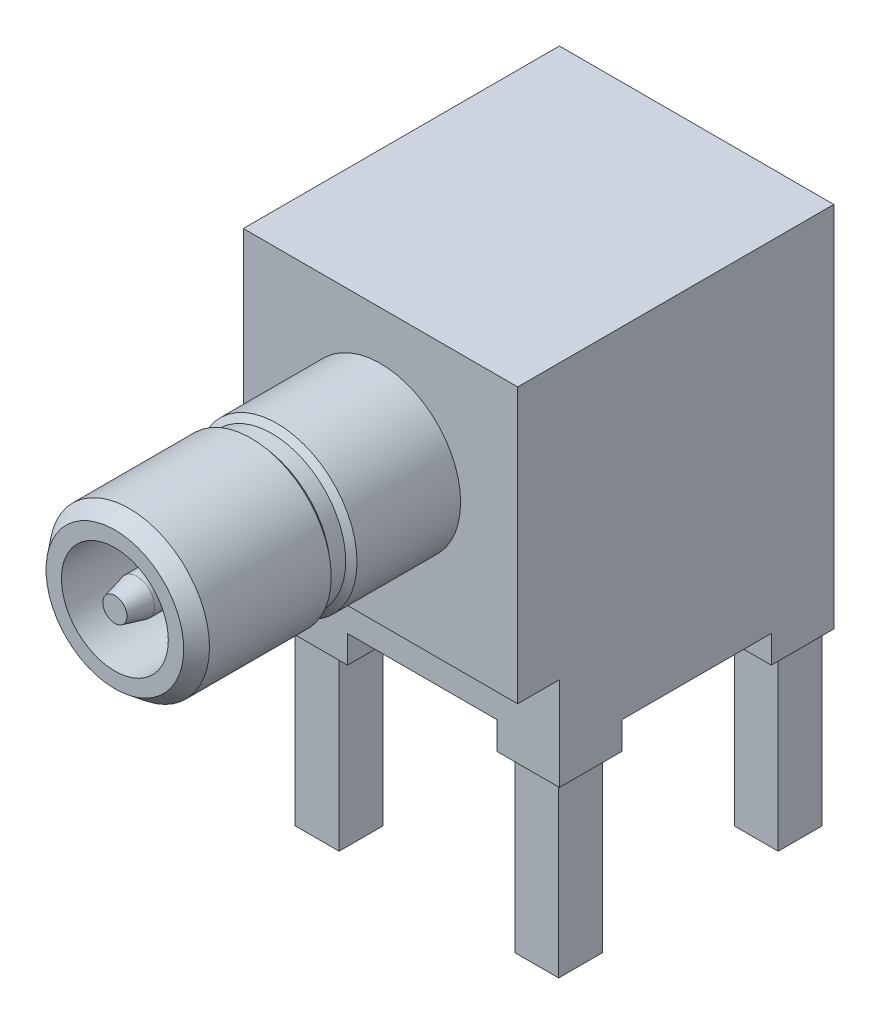
from build123d import *

# Parameters (mm, degrees)
SKETCH1_W          = 6.35
SKETCH1_H          = 6.35
EXTRUDE1_DEPTH     = 7.874
SKETCH2_W          = 1.4478
SKETCH2_H          = 1.4478
EXTRUDE2_DEPTH     = 0.635
SKETCH3_W          = 1.016
SKETCH3_H          = 1.016
EXTRUDE3_DEPTH     = 3.937
SKETCH4_R          = 1.693605641
CUT_EXTRUDE1_DEPTH = 0.254
SKETCH5_R          = 0.4826
EXTRUDE4_DEPTH     = 4.826
SKETCH6_W          = 6.35
SKETCH6_H          = 6.35
EXTRUDE5_DEPTH     = 0.9652
SKETCH7_R          = 1.8542
EXTRUDE6_DEPTH     = 6.1468
SKETCH9_R          = 1.236423773
CUT_EXTRUDE2_DEPTH = 5.658092827
SKETCH10_R         = 0.406972167
EXTRUDE7_DEPTH     = 5.658092827
CHAMFER1_SIZE      = 0.508
CHAMFER1_SIZE2     = 0.126658625


with BuildPart() as part:
    # Sketch1 → Extrude1 (new body)
    with BuildSketch(Plane(origin=(0, 0, 0), x_dir=(1, 0, 0), z_dir=(0, 1, 0))):
        with Locations((3.175, 3.175)):
            Rectangle(SKETCH1_W, SKETCH1_H)
    extrude(amount=EXTRUDE1_DEPTH)

    # Sketch2 → Extrude2 (add)
    with BuildSketch(Plane.XZ):
        with Locations((5.6261, -0.7239)):
            Rectangle(SKETCH2_W, SKETCH2_H)
        with Locations((5.6261, -5.6261)):
            Rectangle(SKETCH2_W, SKETCH2_H)
        with Locations((0.7239, -5.6261)):
            Rectangle(SKETCH2_W, SKETCH2_H)
        with Locations((0.7239, -0.7239)):
            Rectangle(SKETCH2_W, SKETCH2_H)
    extrude(amount=EXTRUDE2_DEPTH)

    # Sketch3 → Extrude3 (add)
    with BuildSketch(Plane.XZ.offset(0.635)):
        with Locations((5.715, -0.617649022)):
            Rectangle(SKETCH3_W, SKETCH3_H)
        with Locations((5.715, -5.697649022)):
            Rectangle(SKETCH3_W, SKETCH3_H)
        with Locations((0.635, -5.697649022)):
            Rectangle(SKETCH3_W, SKETCH3_H)
        with Locations((0.635, -0.617649022)):
            Rectangle(SKETCH3_W, SKETCH3_H)
    extrude(amount=EXTRUDE3_DEPTH)

    # Sketch4 → Cut-Extrude1 (cut)
    with BuildSketch(Plane.XZ):
        with Locations(Location((3.175, -3.175, 0), (0, 0, 270))):
            Circle(SKETCH4_R)
    extrude(amount=-CUT_EXTRUDE1_DEPTH, mode=Mode.SUBTRACT)

    # Sketch5 → Extrude4 (add)
    with BuildSketch(Plane.XZ.offset(-0.254)):
        with Locations(Location((3.175, -3.175, 0), (0, 0, 90))):
            Circle(SKETCH5_R)
    extrude(amount=EXTRUDE4_DEPTH)

    # Sketch6 → Extrude5 (add)
    with BuildSketch(Plane.XY):
        with Locations((3.175, 4.699)):
            Rectangle(SKETCH6_W, SKETCH6_H)
    extrude(amount=EXTRUDE5_DEPTH)

    # Sketch7 → Extrude6 (add)
    with BuildSketch(Plane.XY.offset(0.9652)):
        with Locations((3.175, 4.9022)):
            Circle(SKETCH7_R)
    extrude(amount=EXTRUDE6_DEPTH)

    # Sketch8 → Cut-Revolve1 (revolve, cut)
    with BuildSketch(Plane(origin=(0, 4.9022, 0), x_dir=(-1, 0, 0), z_dir=(0, 1, 0))):
        Polygon((-4.767796954, 7.112), (-5.0292, 6.777141647), (-5.0292, 3.959542683), (-4.884349235, 3.83568961), (-4.884349235, 3.47951039), (-5.0292, 3.363076056), (-5.0292, 0.9652), (-5.650551893, 0.9652), (-5.650551893, 7.801111761), align=None)
    revolve(axis=Axis((3.175, 4.9022, 7.112), (0, 0, -1)), mode=Mode.SUBTRACT)

    # Sketch9 → Cut-Extrude2 (cut)
    with BuildSketch(Plane.XY.offset(7.112)):
        with Locations((3.175, 4.9022)):
            Circle(SKETCH9_R)
    extrude(amount=-CUT_EXTRUDE2_DEPTH, mode=Mode.SUBTRACT)

    # Sketch10 → Extrude7 (add)
    with BuildSketch(Plane.XY.offset(1.453907173)):
        with Locations((3.175, 4.9022)):
            Circle(SKETCH10_R)
    extrude(amount=EXTRUDE7_DEPTH)

    # Chamfer1
    chamfer1_edges = [part.edges().sort_by_distance(p)[0] for p in [
        (2.768027833, 4.9022, 7.112),
    ]]
    chamfer1_side = [part.faces().sort_by_distance(p)[0] for p in [
        (2.768027833, 4.9022, 4.282953587),
    ]]
    chamfer(chamfer1_edges, length=CHAMFER1_SIZE, length2=CHAMFER1_SIZE2, reference=chamfer1_side[0])


solid = part.part
